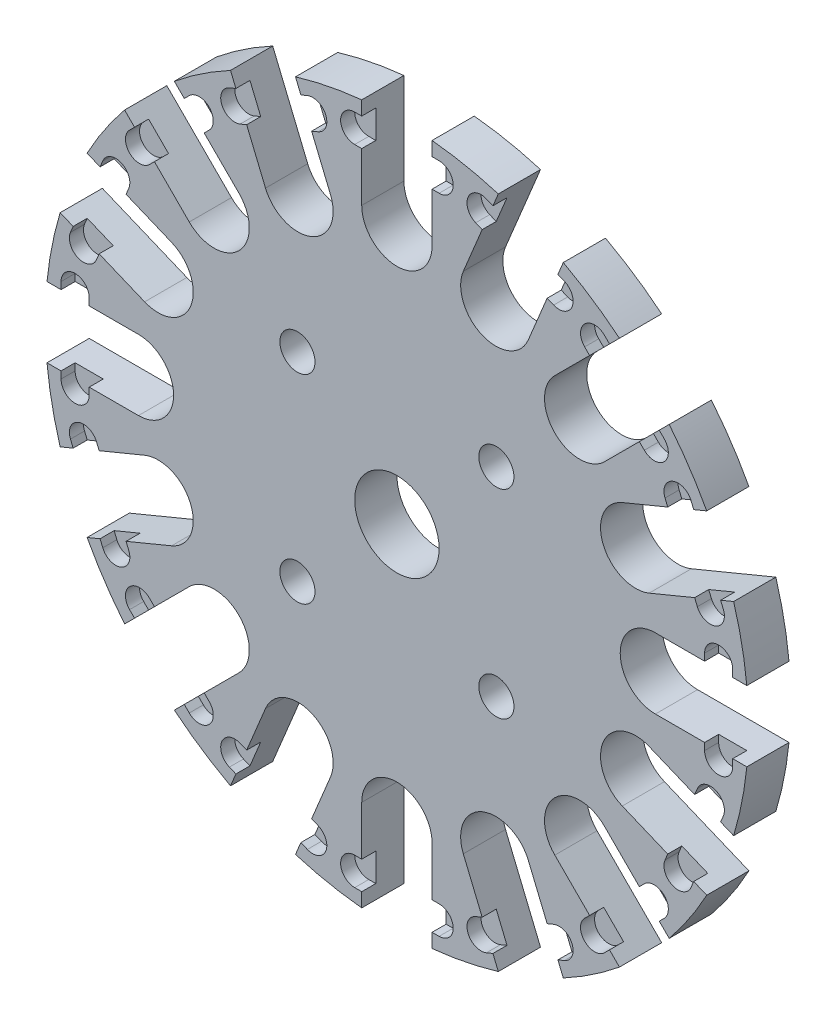
from build123d import *

# Parameters (mm, degrees)
ESQUISSE1_R           = 25
EXTRUSION1_DEPTH      = 3
EXTRUSION3_START      = -10
ESQUISSE2_R           = 3
EXTRUSION3_DEPTH      = 10
TROU_TARAUD_M3X0_51_D = 2.5
EXTRUSION5_DEPTH      = 1


with BuildPart() as part:
    # Esquisse1 → Extrusion1 (new body)
    with BuildSketch(Plane.XY):
        Circle(ESQUISSE1_R)
    extrude(amount=EXTRUSION1_DEPTH)

    # Esquisse2 → Extrusion3 (cut)
    with BuildSketch(Plane.XY.offset(3).offset(EXTRUSION3_START)):
        Circle(ESQUISSE2_R)
        with BuildLine():
            Line((-2.5, 24.874685928), (-2.5, 18.374685928))
            ThreePointArc((-2.5, 18.374685928), (0, 15.874685928), (2.5, 18.374685928))
            Line((2.5, 18.374685928), (2.5, 24.874685928))
            ThreePointArc((2.5, 24.874685928), (0, 25), (-2.5, 24.874685928))
        make_face()
        with BuildLine():
            Line((7.209431359, 23.937921787), (4.721989048, 17.932704826))
            ThreePointArc((4.721989048, 17.932704826), (6.074979299, 14.666297414), (9.341386711, 16.019287664))
            Line((9.341386711, 16.019287664), (11.828829021, 22.024504625))
            ThreePointArc((11.828829021, 22.024504625), (9.567085809, 23.096988313), (7.209431359, 23.937921787))
        make_face()
        with BuildLine():
            Line((15.821292146, 19.356826052), (11.225098069, 14.760631975))
            ThreePointArc((11.225098069, 14.760631975), (11.225098069, 11.225098069), (14.760631975, 11.225098069))
            Line((14.760631975, 11.225098069), (19.356826052, 15.821292146))
            ThreePointArc((19.356826052, 15.821292146), (17.67766953, 17.67766953), (15.821292146, 19.356826052))
        make_face()
        with BuildLine():
            Line((22.024504625, 11.828829021), (16.019287664, 9.341386711))
            ThreePointArc((16.019287664, 9.341386711), (14.666297414, 6.074979299), (17.932704826, 4.721989048))
            Line((17.932704826, 4.721989048), (23.937921787, 7.209431359))
            ThreePointArc((23.937921787, 7.209431359), (23.096988313, 9.567085809), (22.024504625, 11.828829021))
        make_face()
        with BuildLine():
            Line((24.874685928, 2.5), (18.374685928, 2.5))
            ThreePointArc((18.374685928, 2.5), (15.874685928, 0), (18.374685928, -2.5))
            Line((18.374685928, -2.5), (24.874685928, -2.5))
            ThreePointArc((24.874685928, -2.5), (25, 0), (24.874685928, 2.5))
        make_face()
        with BuildLine():
            Line((23.937921787, -7.209431359), (17.932704826, -4.721989048))
            ThreePointArc((17.932704826, -4.721989048), (14.666297414, -6.074979299), (16.019287664, -9.341386711))
            Line((16.019287664, -9.341386711), (22.024504625, -11.828829021))
            ThreePointArc((22.024504625, -11.828829021), (23.096988313, -9.567085809), (23.937921787, -7.209431359))
        make_face()
        with BuildLine():
            Line((19.356826052, -15.821292146), (14.760631975, -11.225098069))
            ThreePointArc((14.760631975, -11.225098069), (11.225098069, -11.225098069), (11.225098069, -14.760631975))
            Line((11.225098069, -14.760631975), (15.821292146, -19.356826052))
            ThreePointArc((15.821292146, -19.356826052), (17.67766953, -17.67766953), (19.356826052, -15.821292146))
        make_face()
        with BuildLine():
            Line((11.828829021, -22.024504625), (9.341386711, -16.019287664))
            ThreePointArc((9.341386711, -16.019287664), (6.074979299, -14.666297414), (4.721989048, -17.932704826))
            Line((4.721989048, -17.932704826), (7.209431359, -23.937921787))
            ThreePointArc((7.209431359, -23.937921787), (9.567085809, -23.096988313), (11.828829021, -22.024504625))
        make_face()
        with BuildLine():
            Line((2.5, -24.874685928), (2.5, -18.374685928))
            ThreePointArc((2.5, -18.374685928), (0, -15.874685928), (-2.5, -18.374685928))
            Line((-2.5, -18.374685928), (-2.5, -24.874685928))
            ThreePointArc((-2.5, -24.874685928), (0, -25), (2.5, -24.874685928))
        make_face()
        with BuildLine():
            Line((-7.209431359, -23.937921787), (-4.721989048, -17.932704826))
            ThreePointArc((-4.721989048, -17.932704826), (-6.074979299, -14.666297414), (-9.341386711, -16.019287664))
            Line((-9.341386711, -16.019287664), (-11.828829021, -22.024504625))
            ThreePointArc((-11.828829021, -22.024504625), (-9.567085809, -23.096988313), (-7.209431359, -23.937921787))
        make_face()
        with BuildLine():
            Line((-15.821292146, -19.356826052), (-11.225098069, -14.760631975))
            ThreePointArc((-11.225098069, -14.760631975), (-11.225098069, -11.225098069), (-14.760631975, -11.225098069))
            Line((-14.760631975, -11.225098069), (-19.356826052, -15.821292146))
            ThreePointArc((-19.356826052, -15.821292146), (-17.67766953, -17.67766953), (-15.821292146, -19.356826052))
        make_face()
        with BuildLine():
            Line((-22.024504625, -11.828829021), (-16.019287664, -9.341386711))
            ThreePointArc((-16.019287664, -9.341386711), (-14.666297414, -6.074979299), (-17.932704826, -4.721989048))
            Line((-17.932704826, -4.721989048), (-23.937921787, -7.209431359))
            ThreePointArc((-23.937921787, -7.209431359), (-23.096988313, -9.567085809), (-22.024504625, -11.828829021))
        make_face()
        with BuildLine():
            Line((-24.874685928, -2.5), (-18.374685928, -2.5))
            ThreePointArc((-18.374685928, -2.5), (-15.874685928, 0), (-18.374685928, 2.5))
            Line((-18.374685928, 2.5), (-24.874685928, 2.5))
            ThreePointArc((-24.874685928, 2.5), (-25, 0), (-24.874685928, -2.5))
        make_face()
        with BuildLine():
            Line((-23.937921787, 7.209431359), (-17.932704826, 4.721989048))
            ThreePointArc((-17.932704826, 4.721989048), (-14.666297414, 6.074979299), (-16.019287664, 9.341386711))
            Line((-16.019287664, 9.341386711), (-22.024504625, 11.828829021))
            ThreePointArc((-22.024504625, 11.828829021), (-23.096988313, 9.567085809), (-23.937921787, 7.209431359))
        make_face()
        with BuildLine():
            Line((-19.356826052, 15.821292146), (-14.760631975, 11.225098069))
            ThreePointArc((-14.760631975, 11.225098069), (-11.225098069, 11.225098069), (-11.225098069, 14.760631975))
            Line((-11.225098069, 14.760631975), (-15.821292146, 19.356826052))
            ThreePointArc((-15.821292146, 19.356826052), (-17.67766953, 17.67766953), (-19.356826052, 15.821292146))
        make_face()
        with BuildLine():
            Line((-11.828829021, 22.024504625), (-9.341386711, 16.019287664))
            ThreePointArc((-9.341386711, 16.019287664), (-6.074979299, 14.666297414), (-4.721989048, 17.932704826))
            Line((-4.721989048, 17.932704826), (-7.209431359, 23.937921787))
            ThreePointArc((-7.209431359, 23.937921787), (-9.567085809, 23.096988313), (-11.828829021, 22.024504625))
        make_face()
    extrude(amount=EXTRUSION3_DEPTH, mode=Mode.SUBTRACT)

    # Trou taraudé M3x0.51 (through all)
    with Locations(Plane(origin=(-7.071067812, 7.071067812, 3), x_dir=(1, 0, 0), z_dir=(0, 0, 1))):
        with Locations((0, 0), (14.142135624, 0), (14.142135624, -14.142135624), (0, -14.142135624)):
            Hole(TROU_TARAUD_M3X0_51_D / 2)

    # Esquisse8 → Extrusion5 (cut)
    with BuildSketch(Plane.XY.offset(3)):
        with BuildLine():
            Line((-2.5, 23.874685928), (-3, 23.874685928))
            ThreePointArc((-3, 23.874685928), (-4, 22.874685928), (-3, 21.874685928))
            Line((-3, 21.874685928), (-2.5, 21.874685928))
            Line((-2.5, 21.874685928), (-2.5, 23.874685928))
        make_face()
        with BuildLine():
            Line((6.826747926, 23.014042255), (6.36480816, 23.205383971))
            ThreePointArc((6.36480816, 23.205383971), (5.058245195, 22.664187871), (5.599441295, 21.357624906))
            Line((5.599441295, 21.357624906), (6.061381061, 21.16628319))
            Line((6.061381061, 21.16628319), (6.826747926, 23.014042255))
        make_face()
        with BuildLine():
            Line((2.5, 23.874685928), (3, 23.874685928))
            ThreePointArc((3, 23.874685928), (4, 22.874685928), (3, 21.874685928))
            Line((3, 21.874685928), (2.5, 21.874685928))
            Line((2.5, 21.874685928), (2.5, 23.874685928))
        make_face()
        with BuildLine():
            Line((11.446145589, 21.100625093), (11.908085355, 20.909283377))
            ThreePointArc((11.908085355, 20.909283377), (12.449281455, 19.602720412), (11.14271849, 19.061524312))
            Line((11.14271849, 19.061524312), (10.680778724, 19.252866028))
            Line((10.680778724, 19.252866028), (11.446145589, 21.100625093))
        make_face()
        with BuildLine():
            Line((15.114185365, 18.649719271), (14.760631975, 19.003272662))
            ThreePointArc((14.760631975, 19.003272662), (13.346418412, 19.003272662), (13.346418412, 17.589059099))
            Line((13.346418412, 17.589059099), (13.699971803, 17.235505709))
            Line((13.699971803, 17.235505709), (15.114185365, 18.649719271))
        make_face()
        with BuildLine():
            Line((18.649719271, 15.114185365), (19.003272662, 14.760631975))
            ThreePointArc((19.003272662, 14.760631975), (19.003272662, 13.346418412), (17.589059099, 13.346418412))
            Line((17.589059099, 13.346418412), (17.235505709, 13.699971803))
            Line((17.235505709, 13.699971803), (18.649719271, 15.114185365))
        make_face()
        with BuildLine():
            Line((21.100625093, 11.446145589), (20.909283377, 11.908085355))
            ThreePointArc((20.909283377, 11.908085355), (19.602720412, 12.449281455), (19.061524312, 11.14271849))
            Line((19.061524312, 11.14271849), (19.252866028, 10.680778724))
            Line((19.252866028, 10.680778724), (21.100625093, 11.446145589))
        make_face()
        with BuildLine():
            Line((23.014042255, 6.826747926), (23.205383971, 6.36480816))
            ThreePointArc((23.205383971, 6.36480816), (22.664187871, 5.058245195), (21.357624906, 5.599441295))
            Line((21.357624906, 5.599441295), (21.16628319, 6.061381061))
            Line((21.16628319, 6.061381061), (23.014042255, 6.826747926))
        make_face()
        with BuildLine():
            Line((23.874685928, 2.5), (23.874685928, 3))
            ThreePointArc((23.874685928, 3), (22.874685928, 4), (21.874685928, 3))
            Line((21.874685928, 3), (21.874685928, 2.5))
            Line((21.874685928, 2.5), (23.874685928, 2.5))
        make_face()
        with BuildLine():
            Line((23.874685928, -2.5), (23.874685928, -3))
            ThreePointArc((23.874685928, -3), (22.874685928, -4), (21.874685928, -3))
            Line((21.874685928, -3), (21.874685928, -2.5))
            Line((21.874685928, -2.5), (23.874685928, -2.5))
        make_face()
        with BuildLine():
            Line((23.014042255, -6.826747926), (23.205383971, -6.36480816))
            ThreePointArc((23.205383971, -6.36480816), (22.664187871, -5.058245195), (21.357624906, -5.599441295))
            Line((21.357624906, -5.599441295), (21.16628319, -6.061381061))
            Line((21.16628319, -6.061381061), (23.014042255, -6.826747926))
        make_face()
        with BuildLine():
            Line((21.100625093, -11.446145589), (20.909283377, -11.908085355))
            ThreePointArc((20.909283377, -11.908085355), (19.602720412, -12.449281455), (19.061524312, -11.14271849))
            Line((19.061524312, -11.14271849), (19.252866028, -10.680778724))
            Line((19.252866028, -10.680778724), (21.100625093, -11.446145589))
        make_face()
        with BuildLine():
            Line((18.649719271, -15.114185365), (19.003272662, -14.760631975))
            ThreePointArc((19.003272662, -14.760631975), (19.003272662, -13.346418412), (17.589059099, -13.346418412))
            Line((17.589059099, -13.346418412), (17.235505709, -13.699971803))
            Line((17.235505709, -13.699971803), (18.649719271, -15.114185365))
        make_face()
        with BuildLine():
            Line((15.114185365, -18.649719271), (14.760631975, -19.003272662))
            ThreePointArc((14.760631975, -19.003272662), (13.346418412, -19.003272662), (13.346418412, -17.589059099))
            Line((13.346418412, -17.589059099), (13.699971803, -17.235505709))
            Line((13.699971803, -17.235505709), (15.114185365, -18.649719271))
        make_face()
        with BuildLine():
            Line((11.446145589, -21.100625093), (11.908085355, -20.909283377))
            ThreePointArc((11.908085355, -20.909283377), (12.449281455, -19.602720412), (11.14271849, -19.061524312))
            Line((11.14271849, -19.061524312), (10.680778724, -19.252866028))
            Line((10.680778724, -19.252866028), (11.446145589, -21.100625093))
        make_face()
        with BuildLine():
            Line((6.826747926, -23.014042255), (6.36480816, -23.205383971))
            ThreePointArc((6.36480816, -23.205383971), (5.058245195, -22.664187871), (5.599441295, -21.357624906))
            Line((5.599441295, -21.357624906), (6.061381061, -21.16628319))
            Line((6.061381061, -21.16628319), (6.826747926, -23.014042255))
        make_face()
        with BuildLine():
            Line((2.5, -23.874685928), (3, -23.874685928))
            ThreePointArc((3, -23.874685928), (4, -22.874685928), (3, -21.874685928))
            Line((3, -21.874685928), (2.5, -21.874685928))
            Line((2.5, -21.874685928), (2.5, -23.874685928))
        make_face()
        with BuildLine():
            Line((-2.5, -23.874685928), (-3, -23.874685928))
            ThreePointArc((-3, -23.874685928), (-4, -22.874685928), (-3, -21.874685928))
            Line((-3, -21.874685928), (-2.5, -21.874685928))
            Line((-2.5, -21.874685928), (-2.5, -23.874685928))
        make_face()
        with BuildLine():
            Line((-6.826747926, -23.014042255), (-6.36480816, -23.205383971))
            ThreePointArc((-6.36480816, -23.205383971), (-5.058245195, -22.664187871), (-5.599441295, -21.357624906))
            Line((-5.599441295, -21.357624906), (-6.061381061, -21.16628319))
            Line((-6.061381061, -21.16628319), (-6.826747926, -23.014042255))
        make_face()
        with BuildLine():
            Line((-11.446145589, -21.100625093), (-11.908085355, -20.909283377))
            ThreePointArc((-11.908085355, -20.909283377), (-12.449281455, -19.602720412), (-11.14271849, -19.061524312))
            Line((-11.14271849, -19.061524312), (-10.680778724, -19.252866028))
            Line((-10.680778724, -19.252866028), (-11.446145589, -21.100625093))
        make_face()
        with BuildLine():
            Line((-15.114185365, -18.649719271), (-14.760631975, -19.003272662))
            ThreePointArc((-14.760631975, -19.003272662), (-13.346418412, -19.003272662), (-13.346418412, -17.589059099))
            Line((-13.346418412, -17.589059099), (-13.699971803, -17.235505709))
            Line((-13.699971803, -17.235505709), (-15.114185365, -18.649719271))
        make_face()
        with BuildLine():
            Line((-18.649719271, -15.114185365), (-19.003272662, -14.760631975))
            ThreePointArc((-19.003272662, -14.760631975), (-19.003272662, -13.346418412), (-17.589059099, -13.346418412))
            Line((-17.589059099, -13.346418412), (-17.235505709, -13.699971803))
            Line((-17.235505709, -13.699971803), (-18.649719271, -15.114185365))
        make_face()
        with BuildLine():
            Line((-21.100625093, -11.446145589), (-20.909283377, -11.908085355))
            ThreePointArc((-20.909283377, -11.908085355), (-19.602720412, -12.449281455), (-19.061524312, -11.14271849))
            Line((-19.061524312, -11.14271849), (-19.252866028, -10.680778724))
            Line((-19.252866028, -10.680778724), (-21.100625093, -11.446145589))
        make_face()
        with BuildLine():
            Line((-23.014042255, -6.826747926), (-23.205383971, -6.36480816))
            ThreePointArc((-23.205383971, -6.36480816), (-22.664187871, -5.058245195), (-21.357624906, -5.599441295))
            Line((-21.357624906, -5.599441295), (-21.16628319, -6.061381061))
            Line((-21.16628319, -6.061381061), (-23.014042255, -6.826747926))
        make_face()
        with BuildLine():
            Line((-23.874685928, -2.5), (-23.874685928, -3))
            ThreePointArc((-23.874685928, -3), (-22.874685928, -4), (-21.874685928, -3))
            Line((-21.874685928, -3), (-21.874685928, -2.5))
            Line((-21.874685928, -2.5), (-23.874685928, -2.5))
        make_face()
        with BuildLine():
            Line((-23.874685928, 2.5), (-23.874685928, 3))
            ThreePointArc((-23.874685928, 3), (-22.874685928, 4), (-21.874685928, 3))
            Line((-21.874685928, 3), (-21.874685928, 2.5))
            Line((-21.874685928, 2.5), (-23.874685928, 2.5))
        make_face()
        with BuildLine():
            Line((-23.014042255, 6.826747926), (-23.205383971, 6.36480816))
            ThreePointArc((-23.205383971, 6.36480816), (-22.664187871, 5.058245195), (-21.357624906, 5.599441295))
            Line((-21.357624906, 5.599441295), (-21.16628319, 6.061381061))
            Line((-21.16628319, 6.061381061), (-23.014042255, 6.826747926))
        make_face()
        with BuildLine():
            Line((-21.100625093, 11.446145589), (-20.909283377, 11.908085355))
            ThreePointArc((-20.909283377, 11.908085355), (-19.602720412, 12.449281455), (-19.061524312, 11.14271849))
            Line((-19.061524312, 11.14271849), (-19.252866028, 10.680778724))
            Line((-19.252866028, 10.680778724), (-21.100625093, 11.446145589))
        make_face()
        with BuildLine():
            Line((-18.649719271, 15.114185365), (-19.003272662, 14.760631975))
            ThreePointArc((-19.003272662, 14.760631975), (-19.003272662, 13.346418412), (-17.589059099, 13.346418412))
            Line((-17.589059099, 13.346418412), (-17.235505709, 13.699971803))
            Line((-17.235505709, 13.699971803), (-18.649719271, 15.114185365))
        make_face()
        with BuildLine():
            Line((-15.114185365, 18.649719271), (-14.760631975, 19.003272662))
            ThreePointArc((-14.760631975, 19.003272662), (-13.346418412, 19.003272662), (-13.346418412, 17.589059099))
            Line((-13.346418412, 17.589059099), (-13.699971803, 17.235505709))
            Line((-13.699971803, 17.235505709), (-15.114185365, 18.649719271))
        make_face()
        with BuildLine():
            Line((-11.446145589, 21.100625093), (-11.908085355, 20.909283377))
            ThreePointArc((-11.908085355, 20.909283377), (-12.449281455, 19.602720412), (-11.14271849, 19.061524312))
            Line((-11.14271849, 19.061524312), (-10.680778724, 19.252866028))
            Line((-10.680778724, 19.252866028), (-11.446145589, 21.100625093))
        make_face()
        with BuildLine():
            Line((-6.826747926, 23.014042255), (-6.36480816, 23.205383971))
            ThreePointArc((-6.36480816, 23.205383971), (-5.058245195, 22.664187871), (-5.599441295, 21.357624906))
            Line((-5.599441295, 21.357624906), (-6.061381061, 21.16628319))
            Line((-6.061381061, 21.16628319), (-6.826747926, 23.014042255))
        make_face()
    extrude(amount=-EXTRUSION5_DEPTH, mode=Mode.SUBTRACT)


solid = part.part
